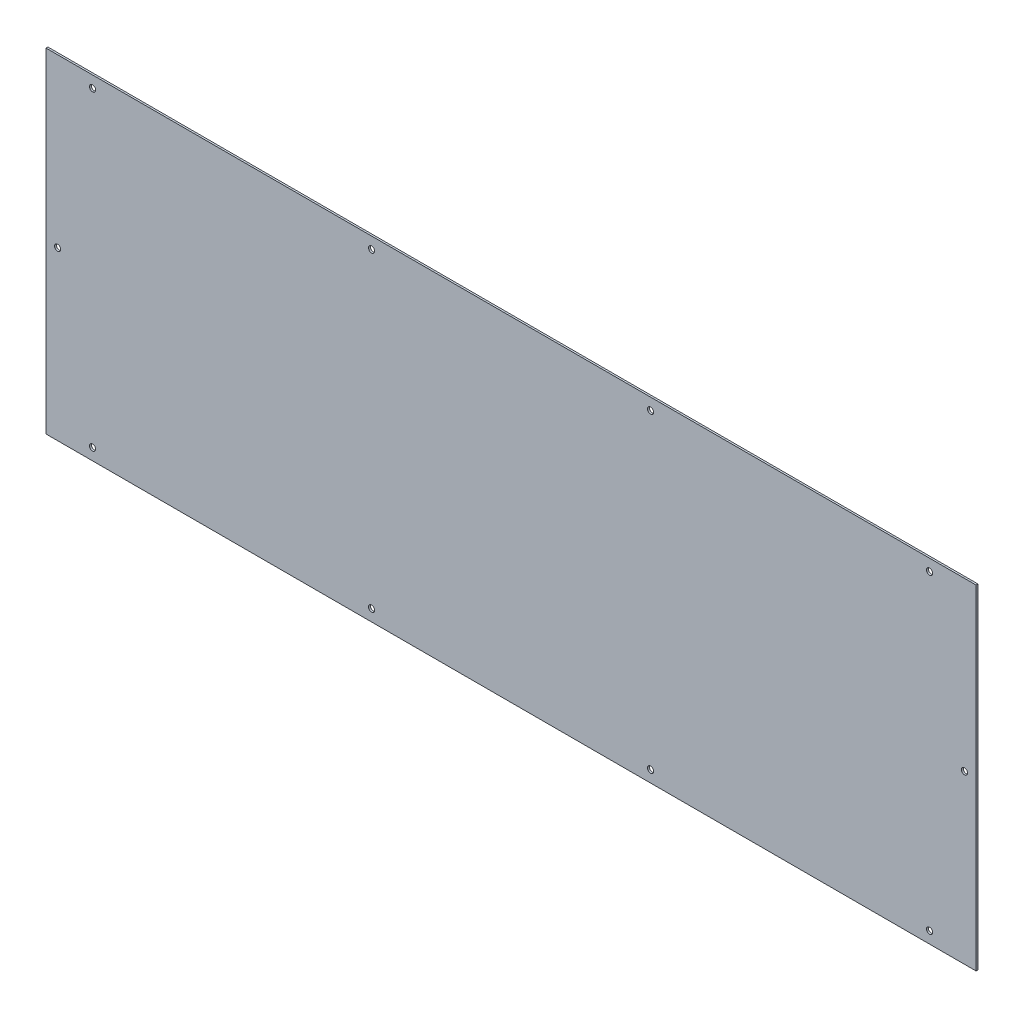
from build123d import *

# Parameters (mm, degrees)
SKETCH1_W            = 999
SKETCH1_H            = 359
BOSS_EXTRUDE1_DEPTH  = 2
M6_CLEARANCE_HOLE1_D = 6.6
LPATTERN1_COUNT      = 4
LPATTERN1_PITCH      = 299.666666667
MIRROR1_COPY_1_D     = 6.6
MIRROR1_COPY_2_D     = 6.6
MIRROR1_COPY_3_D     = 6.6
M6_CLEARANCE_HOLE2_D = 6.6


with BuildPart() as part:
    # Sketch1 → Boss-Extrude1 (new body)
    with BuildSketch(Plane.XY):
        Rectangle(SKETCH1_W, SKETCH1_H)
    extrude(amount=BOSS_EXTRUDE1_DEPTH)

    # M6 Clearance Hole1 (through all)
    with Locations(Plane.XY.offset(2)):
        with Locations((-449.5, 167)):
            m6_clearance_hole1 = Hole(M6_CLEARANCE_HOLE1_D / 2)

    # LPattern1: M6 Clearance Hole1 ×4
    with Locations(*[(i * LPATTERN1_PITCH, 0, 0) for i in range(1, LPATTERN1_COUNT)]):
        add(m6_clearance_hole1, mode=Mode.SUBTRACT)

    # Mirror1: M6 Clearance Hole1 across plane
    add(m6_clearance_hole1.mirror(Plane.ZX), mode=Mode.SUBTRACT)

    # Mirror1 copy 1 (through all)
    with Locations(Plane(origin=(299.666666667, 0, 2), x_dir=(1, 0, 0), z_dir=(0, 0, 1))):
        with Locations((-449.5, -167)):
            Hole(MIRROR1_COPY_1_D / 2)

    # Mirror1 copy 2 (through all)
    with Locations(Plane(origin=(599.333333333, 0, 2), x_dir=(1, 0, 0), z_dir=(0, 0, 1))):
        with Locations((-449.5, -167)):
            Hole(MIRROR1_COPY_2_D / 2)

    # Mirror1 copy 3 (through all)
    with Locations(Plane(origin=(899, 0, 2), x_dir=(1, 0, 0), z_dir=(0, 0, 1))):
        with Locations((-449.5, -167)):
            Hole(MIRROR1_COPY_3_D / 2)

    # M6 Clearance Hole2 (through all)
    with Locations(Plane.XY.offset(2)):
        with Locations((-487, 0)):
            m6_clearance_hole2 = Hole(M6_CLEARANCE_HOLE2_D / 2)

    # Mirror2: M6 Clearance Hole2 across plane
    add(m6_clearance_hole2.mirror(Plane(origin=(0, 0, 0), x_dir=(0, 0, 1), z_dir=(1, 0, 0))), mode=Mode.SUBTRACT)


solid = part.part
